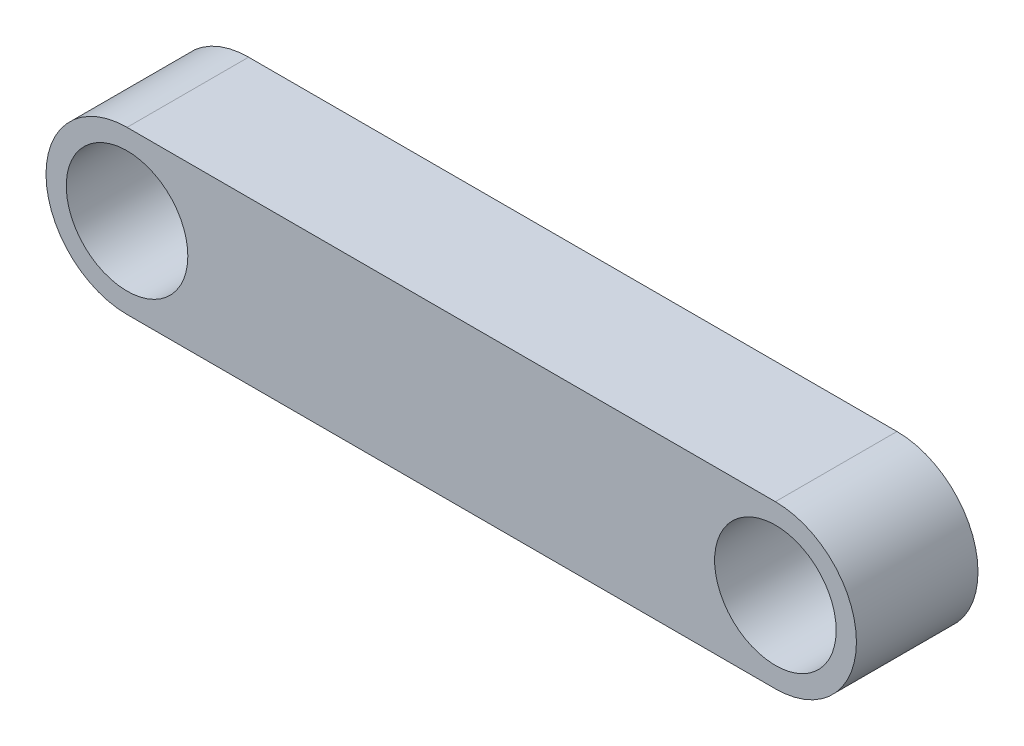
from build123d import *

# Parameters (mm, degrees)
SKETCH_1_R      = 1.5
EXTRUDE_1_DEPTH = 3


with BuildPart() as part:
    # 草图1 → 凸台-拉伸1 (new body)
    with BuildSketch(Plane.XY):
        with BuildLine():
            Line((-8, -2), (8, -2))
            ThreePointArc((8, -2), (10, 0), (8, 2))
            Line((8, 2), (-8, 2))
            ThreePointArc((-8, 2), (-10, 0), (-8, -2))
        make_face()
        with Locations((-8, 0)):
            Circle(SKETCH_1_R, mode=Mode.SUBTRACT)
        with Locations((8, 0)):
            Circle(SKETCH_1_R, mode=Mode.SUBTRACT)
    extrude(amount=EXTRUDE_1_DEPTH)


solid = part.part
